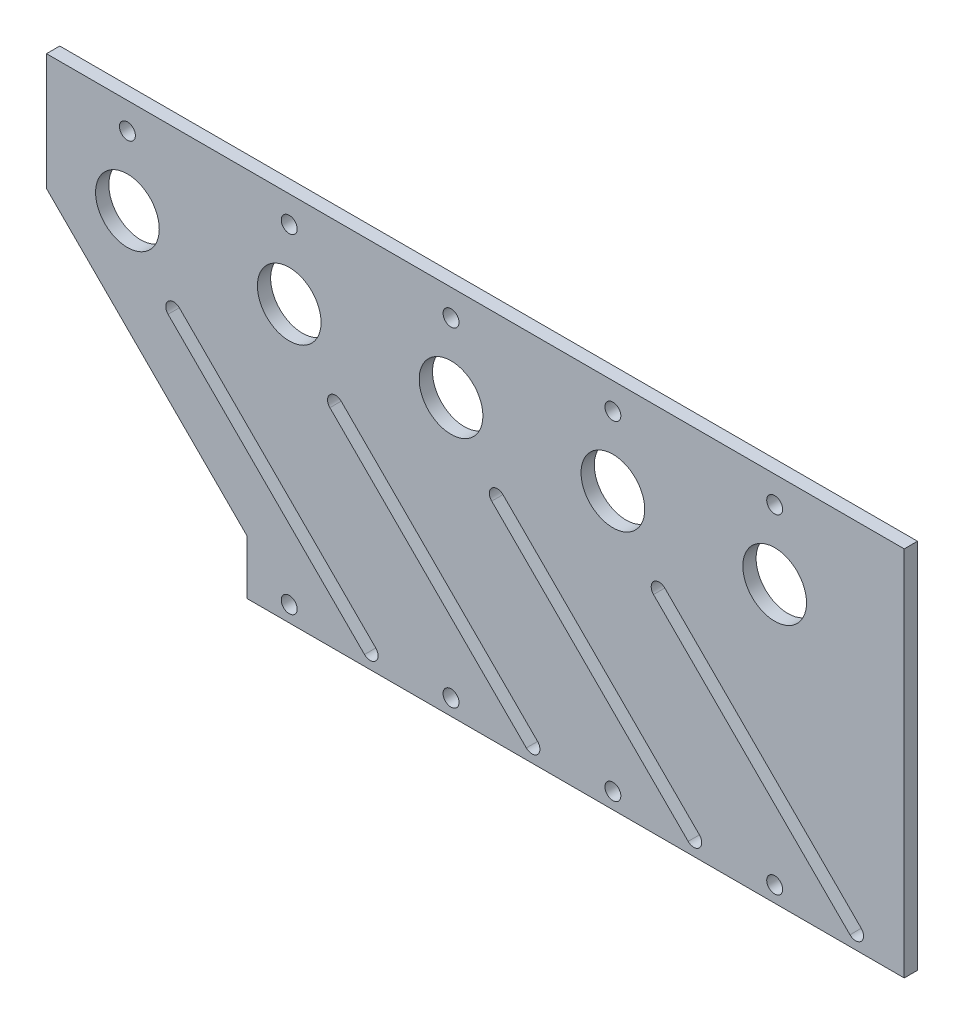
from build123d import *

# Parameters (mm, degrees)
SKETCH_1_W             = 300
SKETCH_1_H             = 70
EXTRUDE_1_DEPTH        = 2.5
SKETCH_2_R             = 1.5
SKETCH_2_R_2           = 6
CUT_EXTRUDE_1_DEPTH    = 155.04950503
PATTERN_LINEAR_1_COUNT = 9
PATTERN_LINEAR_1_PITCH = 30.48
CUT_EXTRUDE_2_DEPTH    = 10


with BuildPart() as part:
    # 草图1 → 凸台-拉伸1 (new body)
    with BuildSketch(Plane.XY):
        Rectangle(SKETCH_1_W, SKETCH_1_H)
    extrude(amount=EXTRUDE_1_DEPTH)

    # 草图2 → 切除-拉伸1 (cut, through all)
    with BuildSketch(Plane.XY.offset(2.5)):
        with Locations((-118.24, -32)):
            Circle(SKETCH_2_R)
        with Locations((-118.24, 30)):
            Circle(SKETCH_2_R)
        with Locations((-118.24, 17)):
            Circle(SKETCH_2_R_2)
        with BuildLine():
            Line((-104.060660172, -33.060660172), (-141.060660172, 3.939339828))
            ThreePointArc((-141.060660172, 3.939339828), (-141.060660172, 6.060660172), (-138.939339828, 6.060660172))
            Line((-138.939339828, 6.060660172), (-101.939339828, -30.939339828))
            ThreePointArc((-101.939339828, -30.939339828), (-101.939339828, -33.060660172), (-104.060660172, -33.060660172))
        make_face()
    cut_extrude_1 = extrude(amount=-CUT_EXTRUDE_1_DEPTH, mode=Mode.SUBTRACT)

    # 阵列(线性)1: 切除-拉伸1 ×9
    with Locations(*[(i * PATTERN_LINEAR_1_PITCH, 0, 0) for i in range(1, PATTERN_LINEAR_1_COUNT)]):
        add(cut_extrude_1, mode=Mode.SUBTRACT)

    # 草图3 → 切除-拉伸2 (cut)
    with BuildSketch(Plane.XY.offset(2.5)):
        Polygon((-11.56, 35), (-11.56, 13), (26.16, -24.72), (26.16, -35), (-150, -35), (-150, 35), align=None)
    extrude(amount=-CUT_EXTRUDE_2_DEPTH, mode=Mode.SUBTRACT)


solid = part.part
